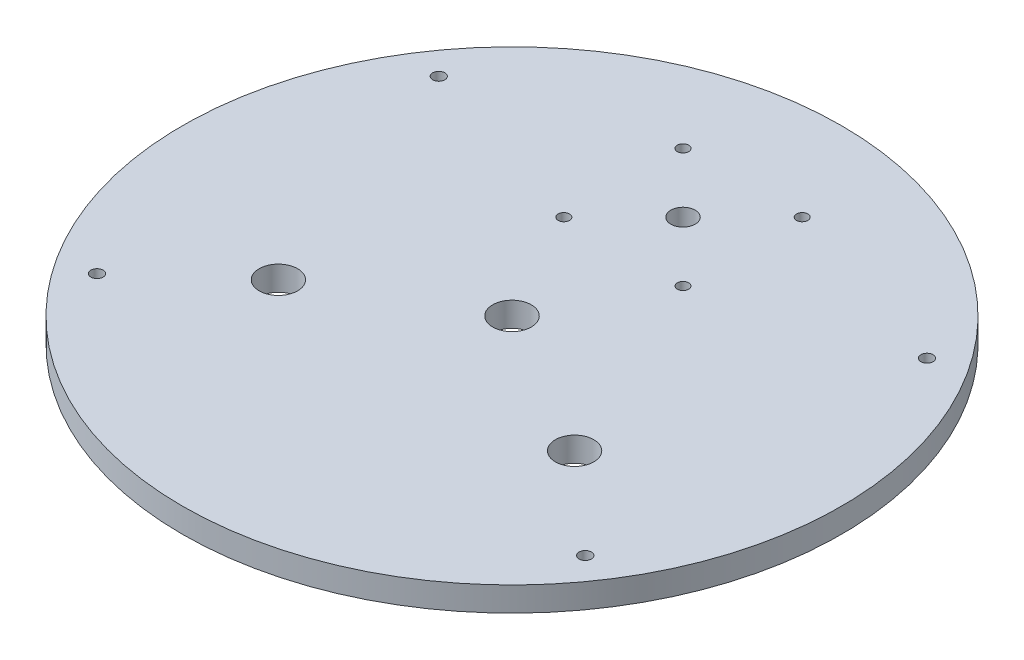
from build123d import *

# Parameters (mm, degrees)
SKETCH1_R           = 85.725
BOSS_EXTRUDE1_DEPTH = 6.35
CUT_EXTRUDE1_REACH  = 123.4
SKETCH2_R           = 1.5875
CUT_EXTRUDE2_REACH  = 123.4
SKETCH3_R           = 3.175
SKETCH3_R_2         = 5
CUT_EXTRUDE3_REACH  = 123.4
SKETCH5_R           = 1.4732
CENTER_HOLE_REACH   = 123.4
SKETCH6_R           = 5.0165


with BuildPart() as part:
    # Sketch1 → Boss-Extrude1 (new body)
    with BuildSketch(Plane(origin=(0, 0, 0), x_dir=(1, 0, 0), z_dir=(0, 1, 0))):
        Circle(SKETCH1_R)
    extrude(amount=BOSS_EXTRUDE1_DEPTH)

    # Sketch2 → Cut-Extrude1 (cut, up to next)
    with BuildSketch(Plane(origin=(0, 6.35, 0), x_dir=(1, 0, 0), z_dir=(0, 1, 0)), mode=Mode.PRIVATE) as cut_extrude1_sk1:
        with Locations((-63.5, 44.45)):
            Circle(SKETCH2_R)
    cut_extrude1_tool1 = extrude(cut_extrude1_sk1.sketch, amount=-CUT_EXTRUDE1_REACH, mode=Mode.PRIVATE) & part.part
    # Sketch2 → Cut-Extrude1 (cut, up to next)
    with BuildSketch(Plane(origin=(0, 6.35, 0), x_dir=(1, 0, 0), z_dir=(0, 1, 0)), mode=Mode.PRIVATE) as cut_extrude1_sk2:
        with Locations((63.5, 44.45)):
            Circle(SKETCH2_R)
    cut_extrude1_tool2 = extrude(cut_extrude1_sk2.sketch, amount=-CUT_EXTRUDE1_REACH, mode=Mode.PRIVATE) & part.part
    # Sketch2 → Cut-Extrude1 (cut, up to next)
    with BuildSketch(Plane(origin=(0, 6.35, 0), x_dir=(1, 0, 0), z_dir=(0, 1, 0)), mode=Mode.PRIVATE) as cut_extrude1_sk3:
        with Locations((-63.5, -44.45)):
            Circle(SKETCH2_R)
    cut_extrude1_tool3 = extrude(cut_extrude1_sk3.sketch, amount=-CUT_EXTRUDE1_REACH, mode=Mode.PRIVATE) & part.part
    # Sketch2 → Cut-Extrude1 (cut, up to next)
    with BuildSketch(Plane(origin=(0, 6.35, 0), x_dir=(1, 0, 0), z_dir=(0, 1, 0)), mode=Mode.PRIVATE) as cut_extrude1_sk4:
        with Locations((63.5, -44.45)):
            Circle(SKETCH2_R)
    cut_extrude1_tool4 = extrude(cut_extrude1_sk4.sketch, amount=-CUT_EXTRUDE1_REACH, mode=Mode.PRIVATE) & part.part
    add(cut_extrude1_tool1.solids().sort_by_distance((-63.5, 6.35, -44.45))[0], mode=Mode.SUBTRACT)
    add(cut_extrude1_tool2.solids().sort_by_distance((63.5, 6.35, -44.45))[0], mode=Mode.SUBTRACT)
    add(cut_extrude1_tool3.solids().sort_by_distance((-63.5, 6.35, 44.45))[0], mode=Mode.SUBTRACT)
    add(cut_extrude1_tool4.solids().sort_by_distance((63.5, 6.35, 44.45))[0], mode=Mode.SUBTRACT)

    # Sketch3 → Cut-Extrude2 (cut, up to next)
    with BuildSketch(Plane(origin=(0, 6.35, 0), x_dir=(1, 0, 0), z_dir=(0, 1, 0)), mode=Mode.PRIVATE) as cut_extrude2_sk1:
        with Locations((0, 44.482258)):
            Circle(SKETCH3_R)
    cut_extrude2_tool1 = extrude(cut_extrude2_sk1.sketch, amount=-CUT_EXTRUDE2_REACH, mode=Mode.PRIVATE) & part.part
    # Sketch3 → Cut-Extrude2 (cut, up to next)
    with BuildSketch(Plane(origin=(0, 6.35, 0), x_dir=(1, 0, 0), z_dir=(0, 1, 0)), mode=Mode.PRIVATE) as cut_extrude2_sk2:
        with Locations((-38.522765446, -22.241129)):
            Circle(SKETCH3_R_2)
    cut_extrude2_tool2 = extrude(cut_extrude2_sk2.sketch, amount=-CUT_EXTRUDE2_REACH, mode=Mode.PRIVATE) & part.part
    # Sketch3 → Cut-Extrude2 (cut, up to next)
    with BuildSketch(Plane(origin=(0, 6.35, 0), x_dir=(1, 0, 0), z_dir=(0, 1, 0)), mode=Mode.PRIVATE) as cut_extrude2_sk3:
        with Locations((38.522765446, -22.241129)):
            Circle(SKETCH3_R_2)
    cut_extrude2_tool3 = extrude(cut_extrude2_sk3.sketch, amount=-CUT_EXTRUDE2_REACH, mode=Mode.PRIVATE) & part.part
    add(cut_extrude2_tool1.solids().sort_by_distance((0, 6.35, -44.482258))[0], mode=Mode.SUBTRACT)
    add(cut_extrude2_tool2.solids().sort_by_distance((-38.522765, 6.35, 22.241129))[0], mode=Mode.SUBTRACT)
    add(cut_extrude2_tool3.solids().sort_by_distance((38.522765, 6.35, 22.241129))[0], mode=Mode.SUBTRACT)

    # Sketch5 → Cut-Extrude3 (cut, up to next)
    with BuildSketch(Plane(origin=(0, 6.35, 0), x_dir=(1, 0, 0), z_dir=(0, 1, 0)), mode=Mode.PRIVATE) as cut_extrude3_sk1:
        with Locations((-15.50035, 59.982608)):
            Circle(SKETCH5_R)
    cut_extrude3_tool1 = extrude(cut_extrude3_sk1.sketch, amount=-CUT_EXTRUDE3_REACH, mode=Mode.PRIVATE) & part.part
    # Sketch5 → Cut-Extrude3 (cut, up to next)
    with BuildSketch(Plane(origin=(0, 6.35, 0), x_dir=(1, 0, 0), z_dir=(0, 1, 0)), mode=Mode.PRIVATE) as cut_extrude3_sk2:
        with Locations((15.50035, 59.982608)):
            Circle(SKETCH5_R)
    cut_extrude3_tool2 = extrude(cut_extrude3_sk2.sketch, amount=-CUT_EXTRUDE3_REACH, mode=Mode.PRIVATE) & part.part
    # Sketch5 → Cut-Extrude3 (cut, up to next)
    with BuildSketch(Plane(origin=(0, 6.35, 0), x_dir=(1, 0, 0), z_dir=(0, 1, 0)), mode=Mode.PRIVATE) as cut_extrude3_sk3:
        with Locations((-15.50035, 28.981908)):
            Circle(SKETCH5_R)
    cut_extrude3_tool3 = extrude(cut_extrude3_sk3.sketch, amount=-CUT_EXTRUDE3_REACH, mode=Mode.PRIVATE) & part.part
    # Sketch5 → Cut-Extrude3 (cut, up to next)
    with BuildSketch(Plane(origin=(0, 6.35, 0), x_dir=(1, 0, 0), z_dir=(0, 1, 0)), mode=Mode.PRIVATE) as cut_extrude3_sk4:
        with Locations((15.50035, 28.981908)):
            Circle(SKETCH5_R)
    cut_extrude3_tool4 = extrude(cut_extrude3_sk4.sketch, amount=-CUT_EXTRUDE3_REACH, mode=Mode.PRIVATE) & part.part
    add(cut_extrude3_tool1.solids().sort_by_distance((-15.50035, 6.35, -59.982608))[0], mode=Mode.SUBTRACT)
    add(cut_extrude3_tool2.solids().sort_by_distance((15.50035, 6.35, -59.982608))[0], mode=Mode.SUBTRACT)
    add(cut_extrude3_tool3.solids().sort_by_distance((-15.50035, 6.35, -28.981908))[0], mode=Mode.SUBTRACT)
    add(cut_extrude3_tool4.solids().sort_by_distance((15.50035, 6.35, -28.981908))[0], mode=Mode.SUBTRACT)

    # Sketch6 → center_hole (cut, up to next)
    with BuildSketch(Plane(origin=(0, 6.35, 0), x_dir=(1, 0, 0), z_dir=(0, 1, 0)), mode=Mode.PRIVATE) as center_hole_sk1:
        Circle(SKETCH6_R)
    center_hole_tool1 = extrude(center_hole_sk1.sketch, amount=-CENTER_HOLE_REACH, mode=Mode.PRIVATE) & part.part
    add(center_hole_tool1.solids().sort_by_distance((0, 6.35, 0))[0], mode=Mode.SUBTRACT)


solid = part.part
